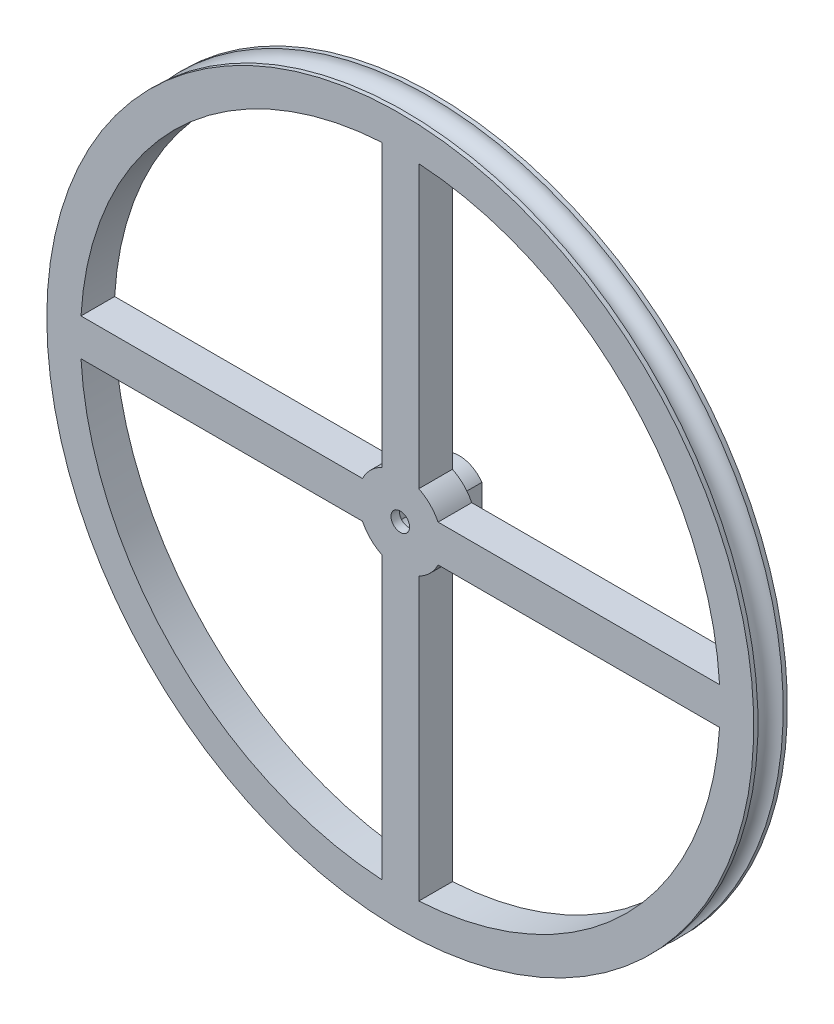
from build123d import *

# Parameters (mm, degrees)
CUT_EXTRUDE2_DEPTH  = 76.605010416
CUT_EXTRUDE3_DEPTH  = 76.605010416
BOSS_EXTRUDE1_START = 3.81
BOSS_EXTRUDE1_DEPTH = 3.81
SKETCH8_R           = 3.81
SKETCH8_R_2         = 1.397
BOSS_EXTRUDE2_DEPTH = 1.27


with BuildPart() as part:
    # Sketch1 → Revolve1 (revolve)
    with BuildSketch(Plane(origin=(0, 0, 0), x_dir=(1, 0, 0), z_dir=(0, 1, 0))):
        with BuildLine():
            Line((-53.34, 0), (-53.34, -0.635))
            ThreePointArc((-53.34, -0.635), (-51.435, -2.54), (-53.34, -4.445))
            Line((-53.34, -4.445), (-53.34, -5.08))
            Line((-53.34, -5.08), (0, -5.08))
            Line((0, -5.08), (0, 0))
            Line((0, 0), (-53.34, 0))
        make_face()
    revolve(axis=Axis((0, 0, 0), (0, 0, 1)))

    # Sketch3 → Cut-Extrude2 (cut, through all)
    with BuildSketch(Plane(origin=(0, 0, 0), x_dir=(-1, 0, 0), z_dir=(0, 0, -1))):
        with BuildLine():
            Line((2.794, 48.179053166), (2.794, 5.702285857))
            ThreePointArc((2.794, 5.702285857), (4.490128061, 4.490128061), (5.702285857, 2.794))
            Line((5.702285857, 2.794), (48.179053166, 2.794))
            ThreePointArc((48.179053166, 2.794), (34.12497326, 34.12497326), (2.794, 48.179053166))
        make_face()
        with BuildLine():
            Line((2.794, -5.702285857), (2.794, -48.179053166))
            ThreePointArc((2.794, -48.179053166), (34.12497326, -34.12497326), (48.179053166, -2.794))
            Line((48.179053166, -2.794), (5.702285857, -2.794))
            ThreePointArc((5.702285857, -2.794), (4.490128061, -4.490128061), (2.794, -5.702285857))
        make_face()
        with BuildLine():
            Line((-5.702285857, -2.794), (-48.179053166, -2.794))
            ThreePointArc((-48.179053166, -2.794), (-34.12497326, -34.12497326), (-2.794, -48.179053166))
            Line((-2.794, -48.179053166), (-2.794, -5.702285857))
            ThreePointArc((-2.794, -5.702285857), (-4.490128061, -4.490128061), (-5.702285857, -2.794))
        make_face()
        with BuildLine():
            Line((-2.794, 5.702285857), (-2.794, 48.179053166))
            ThreePointArc((-2.794, 48.179053166), (-34.12497326, 34.12497326), (-48.179053166, 2.794))
            Line((-48.179053166, 2.794), (-5.702285857, 2.794))
            ThreePointArc((-5.702285857, 2.794), (-4.490128061, 4.490128061), (-2.794, 5.702285857))
        make_face()
    extrude(amount=-CUT_EXTRUDE2_DEPTH, mode=Mode.SUBTRACT)

    # Sketch6 → Cut-Extrude3 (cut, through all)
    with BuildSketch(Plane(origin=(0, 0, 0), x_dir=(-1, 0, 0), z_dir=(0, 0, -1))):
        with BuildLine():
            Line((-2.159, 1.96747554), (-2.159, -1.96747554))
            ThreePointArc((-2.159, -1.96747554), (0, -2.921), (2.159, -1.96747554))
            Line((2.159, -1.96747554), (2.159, 1.96747554))
            ThreePointArc((2.159, 1.96747554), (0, 2.921), (-2.159, 1.96747554))
        make_face()
    extrude(amount=-CUT_EXTRUDE3_DEPTH, mode=Mode.SUBTRACT)

    # Sketch7 → Boss-Extrude1 (add)
    with BuildSketch(Plane(origin=(0, 0, 0), x_dir=(-1, 0, 0), z_dir=(0, 0, -1)).offset(BOSS_EXTRUDE1_START)):
        with BuildLine():
            Line((3.429, -2.409655577), (3.429, 2.409655577))
            ThreePointArc((3.429, 2.409655577), (0, 4.191), (-3.429, 2.409655577))
            Line((-3.429, 2.409655577), (-3.429, -2.409655577))
            ThreePointArc((-3.429, -2.409655577), (0, -4.191), (3.429, -2.409655577))
        make_face()
        with BuildLine():
            Line((2.159, -1.96747554), (2.159, 1.96747554))
            ThreePointArc((2.159, 1.96747554), (0, 2.921), (-2.159, 1.96747554))
            Line((-2.159, 1.96747554), (-2.159, -1.96747554))
            ThreePointArc((-2.159, -1.96747554), (0, -2.921), (2.159, -1.96747554))
        make_face(mode=Mode.SUBTRACT)
    extrude(amount=-BOSS_EXTRUDE1_DEPTH)

    # Sketch8 → Boss-Extrude2 (add)
    with BuildSketch(Plane.XY.offset(5.08)):
        Circle(SKETCH8_R)
        Circle(SKETCH8_R_2, mode=Mode.SUBTRACT)
    extrude(amount=-BOSS_EXTRUDE2_DEPTH)


solid = part.part
